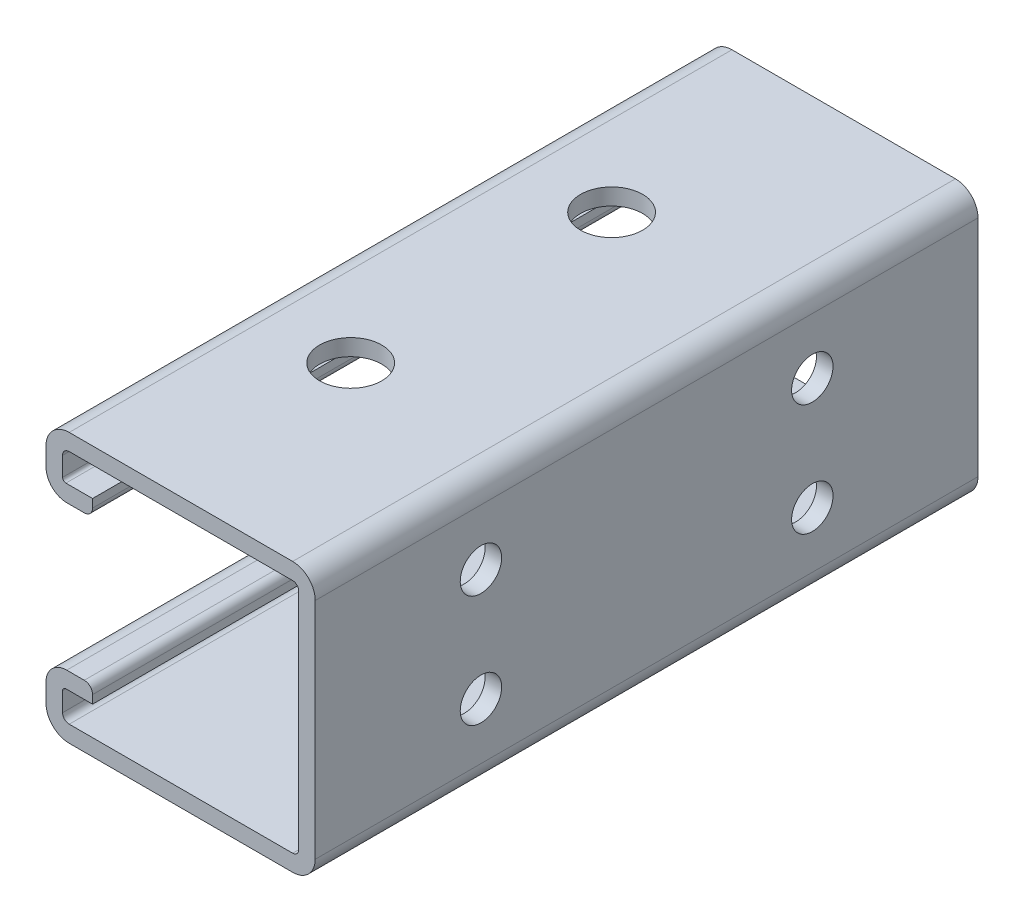
from build123d import *

# Parameters (mm, degrees)
BOSS_EXTRUDE1_DEPTH      = 50.8
BOSS_EXTRUDE1_DEPTH_BACK = 50.8
SKETCH7_R                = 4.7625
CUT_EXTRUDE1_DEPTH       = 45.72
SKETCH8_R                = 3.175
CUT_EXTRUDE2_DEPTH       = 2.54


with BuildPart() as part:
    # Sketch4 → Boss-Extrude1 (new, two sides: drawn at the far end of the back side and taken through both)
    with BuildSketch(Plane.XY.offset(-BOSS_EXTRUDE1_DEPTH_BACK)):
        with BuildLine():
            Line((-17.0815, -20.6375), (17.17675, -20.6375))
            ThreePointArc((17.17675, -20.6375), (19.623869793, -19.623869793), (20.6375, -17.17675))
            Line((20.6375, -17.17675), (20.6375, 17.17675))
            ThreePointArc((20.6375, 17.17675), (19.623869793, 19.623869793), (17.17675, 20.6375))
            Line((17.17675, 20.6375), (-17.0815, 20.6375))
            ThreePointArc((-17.0815, 20.6375), (-19.595971714, 19.595971714), (-20.6375, 17.0815))
            Line((-20.6375, 17.0815), (-20.6375, 14.2875))
            ThreePointArc((-20.6375, 14.2875), (-19.70756403, 12.04243597), (-17.4625, 11.1125))
            Line((-17.4625, 11.1125), (-14.7701, 11.1125))
            ThreePointArc((-14.7701, 11.1125), (-13.872074388, 11.484474388), (-13.5001, 12.3825))
            Line((-13.5001, 12.3825), (-13.5001, 13.6525))
            Line((-13.5001, 13.6525), (-17.5895, 13.6525))
            ThreePointArc((-17.5895, 13.6525), (-17.948710245, 13.801289755), (-18.0975, 14.1605))
            Line((-18.0975, 14.1605), (-18.0975, 17.0815))
            ThreePointArc((-18.0975, 17.0815), (-17.79992049, 17.79992049), (-17.0815, 18.0975))
            Line((-17.0815, 18.0975), (17.17675, 18.0975))
            ThreePointArc((17.17675, 18.0975), (17.827818569, 17.827818569), (18.0975, 17.17675))
            Line((18.0975, 17.17675), (18.0975, -17.17675))
            ThreePointArc((18.0975, -17.17675), (17.827818569, -17.827818569), (17.17675, -18.0975))
            Line((17.17675, -18.0975), (-17.0815, -18.0975))
            ThreePointArc((-17.0815, -18.0975), (-17.79992049, -17.79992049), (-18.0975, -17.0815))
            Line((-18.0975, -17.0815), (-18.0975, -14.1605))
            ThreePointArc((-18.0975, -14.1605), (-17.948710245, -13.801289755), (-17.5895, -13.6525))
            Line((-17.5895, -13.6525), (-13.5001, -13.6525))
            Line((-13.5001, -13.6525), (-13.5001, -12.3825))
            ThreePointArc((-13.5001, -12.3825), (-13.872074388, -11.484474388), (-14.7701, -11.1125))
            Line((-14.7701, -11.1125), (-17.4625, -11.1125))
            ThreePointArc((-17.4625, -11.1125), (-19.70756403, -12.04243597), (-20.6375, -14.2875))
            Line((-20.6375, -14.2875), (-20.6375, -17.0815))
            ThreePointArc((-20.6375, -17.0815), (-19.595971714, -19.595971714), (-17.0815, -20.6375))
        make_face()
    extrude(amount=BOSS_EXTRUDE1_DEPTH + BOSS_EXTRUDE1_DEPTH_BACK)

    # Sketch7 → Cut-Extrude1 (cut)
    with BuildSketch(Plane(origin=(0, 20.6375, 0), x_dir=(1, 0, 0), z_dir=(0, 1, 0))):
        with Locations(Location((-4.73075, -20, 0), (0, 0, 180))):
            Circle(SKETCH7_R)
        with Locations(Location((-4.73075, 20, 0), (0, 0, 180))):
            Circle(SKETCH7_R)
    extrude(amount=-CUT_EXTRUDE1_DEPTH, mode=Mode.SUBTRACT)

    # Sketch8 → Cut-Extrude2 (cut)
    with BuildSketch(Plane(origin=(20.6375, 0, 0), x_dir=(0, 0, -1), z_dir=(1, 0, 0))):
        with Locations(Location((25.4, -8.588375, 0), (0, 0, 90))):
            Circle(SKETCH8_R)
        with Locations(Location((25.4, 8.588375, 0), (0, 0, 180))):
            Circle(SKETCH8_R)
        with Locations(Location((-25.4, -8.588375, 0), (0, 0, 180))):
            Circle(SKETCH8_R)
        with Locations(Location((-25.4, 8.588375, 0), (0, 0, 90))):
            Circle(SKETCH8_R)
    extrude(amount=-CUT_EXTRUDE2_DEPTH, mode=Mode.SUBTRACT)


solid = part.part
